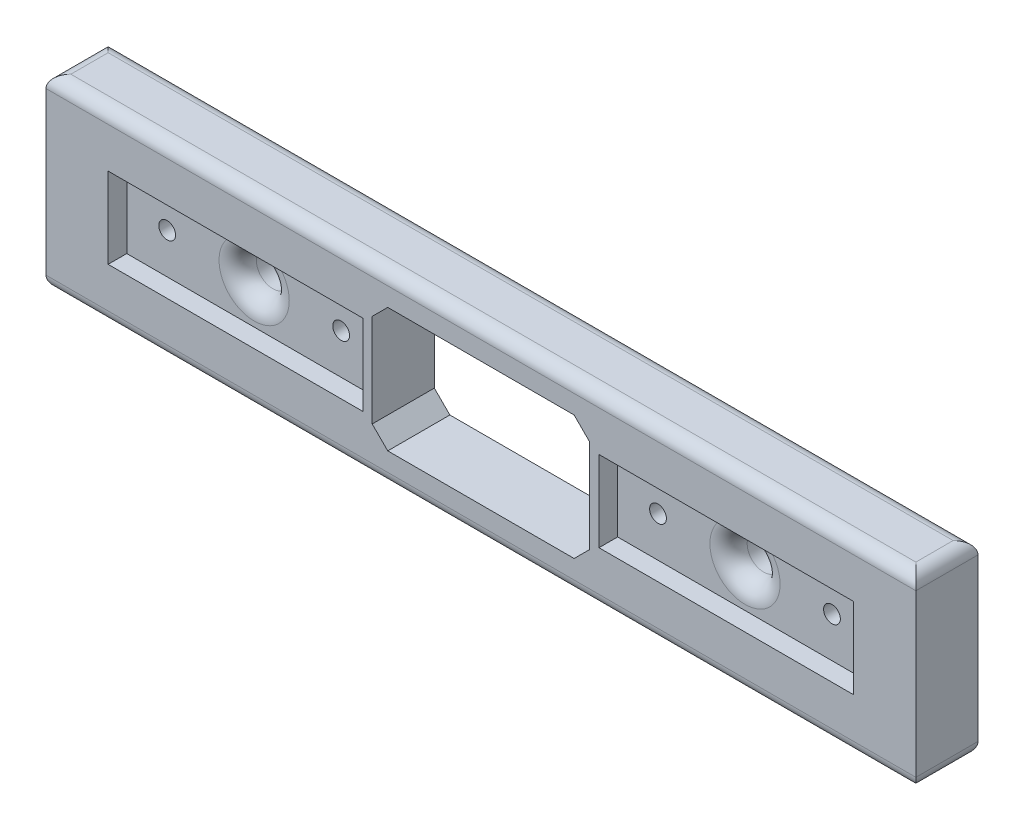
from build123d import *

# Parameters (mm, degrees)
SKETCH1_W             = 140
SKETCH1_H             = 30
SKETCH1_W_2           = 35
SKETCH1_H_2           = 20
BOSS_EXTRUDE1_DEPTH   = 5
SKETCH5_W             = 41
SKETCH5_H             = 13
CUT_EXTRUDE3_DEPTH    = 3
SKETCH6_R             = 2.65
SKETCH6_R_2           = 1.35
CUT_EXTRUDE4_DEPTH    = 72.930522033
SKETCH7_R             = 2.75
CUT_EXTRUDE5_DEPTH    = 2
FILLET1_R             = 3
FILLET1_OF_MIRROR11_R = 3
FILLET2_R             = 2
CHAMFER1_SIZE         = 2.5


with BuildPart() as part:
    # Sketch1 → Boss-Extrude1 (new, symmetric)
    with BuildSketch(Plane.XY):
        Rectangle(SKETCH1_W, SKETCH1_H)
        Rectangle(SKETCH1_W_2, SKETCH1_H_2, mode=Mode.SUBTRACT)
    extrude(amount=BOSS_EXTRUDE1_DEPTH, both=True)

    # Sketch5 → Cut-Extrude3 (cut)
    with BuildSketch(Plane.XY.offset(5)):
        with Locations((-39.5, 0)):
            Rectangle(SKETCH5_W, SKETCH5_H)
    cut_extrude3 = extrude(amount=-CUT_EXTRUDE3_DEPTH, mode=Mode.SUBTRACT)

    # Sketch6 → Cut-Extrude4 (cut, through all)
    with BuildSketch(Plane.XY.offset(2)):
        with Locations((-39.5, 0)):
            Circle(SKETCH6_R)
        with Locations((-25.5, 0)):
            Circle(SKETCH6_R_2)
        with Locations(Location((-53.5, 0, 0), (0, 0, 180))):
            Circle(SKETCH6_R_2)
    cut_extrude4 = extrude(amount=-CUT_EXTRUDE4_DEPTH, mode=Mode.SUBTRACT)

    # Sketch7 → Cut-Extrude5 (cut)
    with BuildSketch(Plane(origin=(0, 0, -5), x_dir=(-1, 0, 0), z_dir=(0, 0, -1))):
        with Locations((53.5, 0)):
            Circle(SKETCH7_R)
        with Locations(Location((25.5, 0, 0), (0, 0, 180))):
            Circle(SKETCH7_R)
    cut_extrude5 = extrude(amount=-CUT_EXTRUDE5_DEPTH, mode=Mode.SUBTRACT)

    # Fillet1
    fillet1_edges = [part.edges().sort_by_distance(p)[0] for p in [
        (-42.15, 0, 2),
    ]]
    fillet(fillet1_edges, radius=FILLET1_R)

    # Mirror11: Cut-Extrude3, Cut-Extrude4, Cut-Extrude5 across plane
    add(cut_extrude3.mirror(Plane(origin=(0, 0, 0), x_dir=(0, 0, 1), z_dir=(1, 0, 0))), mode=Mode.SUBTRACT)
    add(cut_extrude4.mirror(Plane(origin=(0, 0, 0), x_dir=(0, 0, 1), z_dir=(1, 0, 0))), mode=Mode.SUBTRACT)
    add(cut_extrude5.mirror(Plane(origin=(0, 0, 0), x_dir=(0, 0, 1), z_dir=(1, 0, 0))), mode=Mode.SUBTRACT)

    # Fillet1 of Mirror11
    fillet1_of_mirror11_edges = [part.edges().sort_by_distance(p)[0] for p in [
        (42.15, 0, 2),
    ]]
    fillet(fillet1_of_mirror11_edges, radius=FILLET1_OF_MIRROR11_R)

    # Fillet2
    fillet2_edges = [part.edges().sort_by_distance(p)[0] for p in [
        (0, -15, 5),
        (0, -15, -5),
        (0, 15, -5),
        (70, -15, 0),
        (-70, -15, 0),
        (-70, 15, 0),
        (70, 15, 0),
        (0, 15, 5),
    ]]
    fillet(fillet2_edges, radius=FILLET2_R)

    # Chamfer1
    chamfer1_edges = [part.edges().sort_by_distance(p)[0] for p in [
        (17.5, -10, 0),
        (17.5, 10, 0),
        (-17.5, 10, 0),
        (-17.5, -10, 0),
    ]]
    chamfer(chamfer1_edges, length=CHAMFER1_SIZE)


solid = part.part
